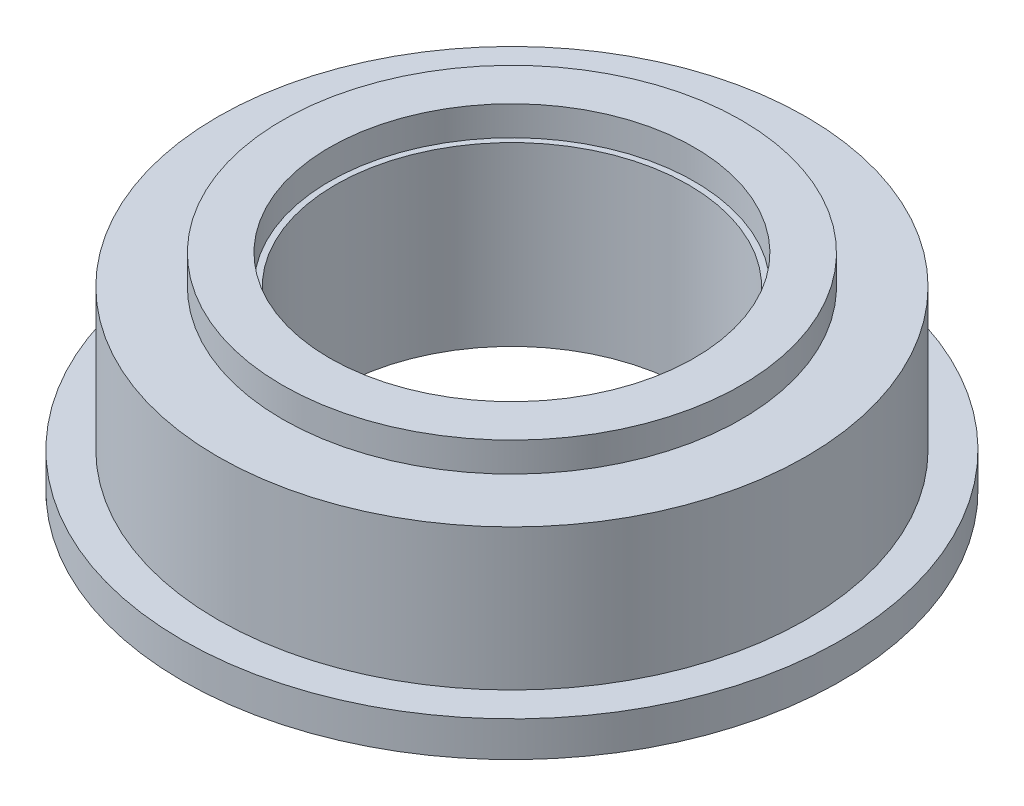
from build123d import *

# Parameters (mm, degrees)
SKETCH_1_R      = 5.6
SKETCH_1_R_2    = 3
EXTRUDE_1_DEPTH = 0.6
SKETCH_2_R      = 5
SKETCH_2_R_2    = 3
EXTRUDE_2_DEPTH = 2.4
SKETCH_3_R      = 3.9
SKETCH_3_R_2    = 3.1
EXTRUDE_3_DEPTH = 0.5


with BuildPart() as part:
    # 草图1 → 凸台-拉伸1 (new body)
    with BuildSketch(Plane(origin=(0, 0, 0), x_dir=(1, 0, 0), z_dir=(0, 1, 0))):
        with Locations(Location((0, 0, 0), (0, 0, 270))):
            Circle(SKETCH_1_R)
        with Locations(Location((0, 0, 0), (0, 0, 270))):
            Circle(SKETCH_1_R_2, mode=Mode.SUBTRACT)
    extrude(amount=EXTRUDE_1_DEPTH)

    # 草图2 → 凸台-拉伸2 (add)
    with BuildSketch(Plane(origin=(0, 0.6, 0), x_dir=(1, 0, 0), z_dir=(0, 1, 0))):
        with Locations(Location((0, 0, 0), (0, 0, 270))):
            Circle(SKETCH_2_R)
        with Locations(Location((0, 0, 0), (0, 0, 270))):
            Circle(SKETCH_2_R_2, mode=Mode.SUBTRACT)
    extrude(amount=EXTRUDE_2_DEPTH)

    # 草图3 → 凸台-拉伸3 (add)
    with BuildSketch(Plane(origin=(0, 3, 0), x_dir=(1, 0, 0), z_dir=(0, 1, 0))):
        with Locations(Location((0, 0, 0), (0, 0, 270))):
            Circle(SKETCH_3_R)
        with Locations(Location((0, 0, 0), (0, 0, 270))):
            Circle(SKETCH_3_R_2, mode=Mode.SUBTRACT)
    extrude(amount=EXTRUDE_3_DEPTH)


solid = part.part
